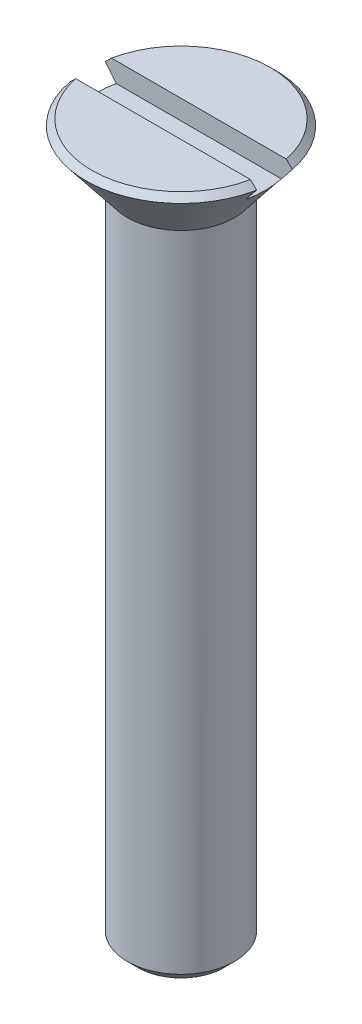
from build123d import *

# Parameters (mm, degrees)
CHAMFER1_SIZE      = 0.3
CHAMFER2_SIZE      = 0.3
CHAMFER2_SIZE2     = 0.213619846
SKETCH2_W          = 6.6
SKETCH2_H          = 1
CUT_EXTRUDE1_DEPTH = 0.55


with BuildPart() as part:
    # Sketch1 → Revolve1 (revolve)
    with BuildSketch(Plane.XY, mode=Mode.PRIVATE) as revolve1_sk:
        Polygon((0, 0), (2.8, 0), (1.5, -1.65), (1.5, -20), (0, -20), align=None)
    revolve(revolve1_sk.sketch.rotate(Axis((0, 0, 0), (0, 1, 0)), 90), axis=Axis((0, 0, 0), (0, 1, 0)))

    # Chamfer1
    chamfer1_edges = [part.edges().sort_by_distance(p)[0] for p in [
        (0, -20, 1.5),
    ]]
    chamfer(chamfer1_edges, length=CHAMFER1_SIZE)

    # Chamfer2
    chamfer2_edges = [part.edges().sort_by_distance(p)[0] for p in [
        (0, 0, 2.8),
    ]]
    chamfer2_side = [part.faces().sort_by_distance(p)[0] for p in [
        (0, 0, 0),
    ]]
    chamfer(chamfer2_edges, length=CHAMFER2_SIZE, length2=CHAMFER2_SIZE2, reference=chamfer2_side[0])

    # Sketch2 → Cut-Extrude1 (cut)
    with BuildSketch(Plane(origin=(0, 0, 0), x_dir=(1, 0, 0), z_dir=(0, 1, 0))):
        Rectangle(SKETCH2_W, SKETCH2_H)
    extrude(amount=-CUT_EXTRUDE1_DEPTH, mode=Mode.SUBTRACT)


solid = part.part
